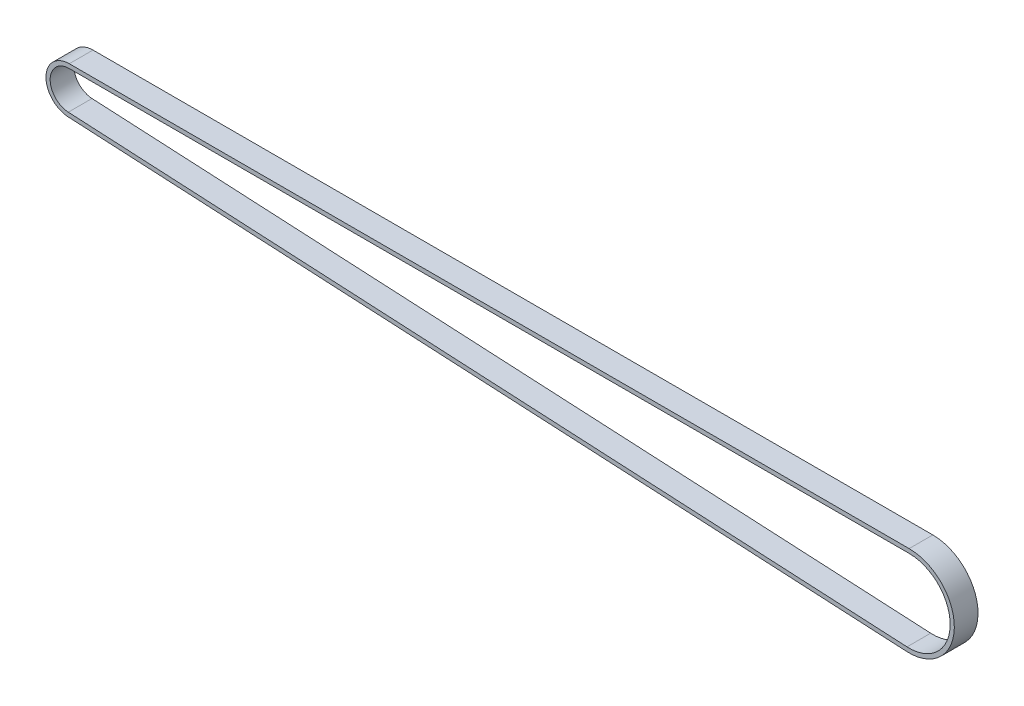
from build123d import *

# Parameters (mm, degrees)
BOSS_EXTRUDE1_DEPTH = 6.35


with BuildPart() as part:
    # Sketch1 → Boss-Extrude1 (new body)
    with BuildSketch(Plane.XY):
        with BuildLine():
            Line((-0.325435853, -6.244581835), (224.515041815, -17.962124282))
            ThreePointArc((224.515041815, -17.962124282), (237.257294404, -6.178129849), (225.1456, 6.253056116))
            Line((225.1456, 6.253056116), (0, 6.253056116))
            ThreePointArc((0, 6.253056116), (-6.250937186, 0.162773084), (-0.325435853, -6.244581835))
        make_face()
        with BuildLine():
            Line((0, 5.135456116), (225.1456, 5.135456116))
            ThreePointArc((225.1456, 5.135456116), (236.140073117, -6.149037643), (224.573206512, -16.846038879))
            Line((224.573206512, -16.846038879), (-0.267271157, -5.128496431))
            ThreePointArc((-0.267271157, -5.128496431), (-5.1337159, 0.133680878), (0, 5.135456116))
        make_face(mode=Mode.SUBTRACT)
    extrude(amount=BOSS_EXTRUDE1_DEPTH)


solid = part.part
